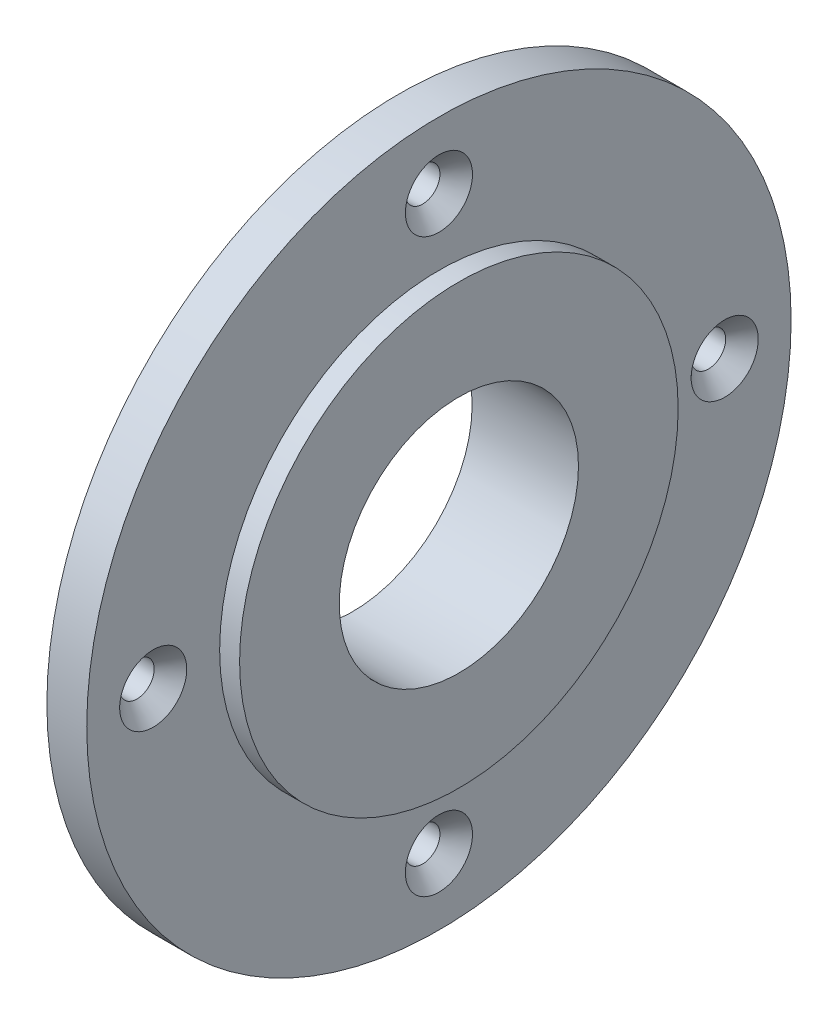
from build123d import *

# Parameters (mm, degrees)
CSK_FOR_M5_COUNTERSUNK_FLAT_HEAD_SCREW1_D           = 5.2
CSK_FOR_M5_COUNTERSUNK_FLAT_HEAD_SCREW1_CSINK_D     = 10.1
CSK_FOR_M5_COUNTERSUNK_FLAT_HEAD_SCREW1_CSINK_ANGLE = 90
CIRPATTERN1_COUNT                                   = 4


with BuildPart() as part:
    # Sketch2 → Revolve1 (revolve)
    with BuildSketch(Plane.XY, mode=Mode.PRIVATE) as revolve1_sk:
        Polygon((-192.905599099, 33), (-195.905599099, 33), (-195.905599099, 53), (-201.905599099, 53), (-201.905599099, 21), (-208.905599099, 21), (-208.905599099, 18), (-192.905599099, 18), align=None)
    revolve(revolve1_sk.sketch.rotate(Axis((0, 0, 0), (-1, 0, 0)), 90), axis=Axis((0, 0, 0), (-1, 0, 0)))

    # CSK for M5 Countersunk Flat Head Screw1 (through all)
    with Locations(Plane(origin=(-195.905599099, 0, 0), x_dir=(0, 0, -1), z_dir=(1, 0, 0))):
        with Locations((0, 43)):
            csk_for_m5_countersunk_flat_head_screw1 = CounterSinkHole(CSK_FOR_M5_COUNTERSUNK_FLAT_HEAD_SCREW1_D / 2, CSK_FOR_M5_COUNTERSUNK_FLAT_HEAD_SCREW1_CSINK_D / 2, counter_sink_angle=CSK_FOR_M5_COUNTERSUNK_FLAT_HEAD_SCREW1_CSINK_ANGLE)

    # CirPattern1: CSK for M5 Countersunk Flat Head Screw1 ×4 about axis
    cirpattern1_axis = Axis((0, 0, 0), (1, 0, 0))
    for i in range(1, CIRPATTERN1_COUNT):
        add(csk_for_m5_countersunk_flat_head_screw1.rotate(cirpattern1_axis, i * 360 / CIRPATTERN1_COUNT), mode=Mode.SUBTRACT)


solid = part.part
